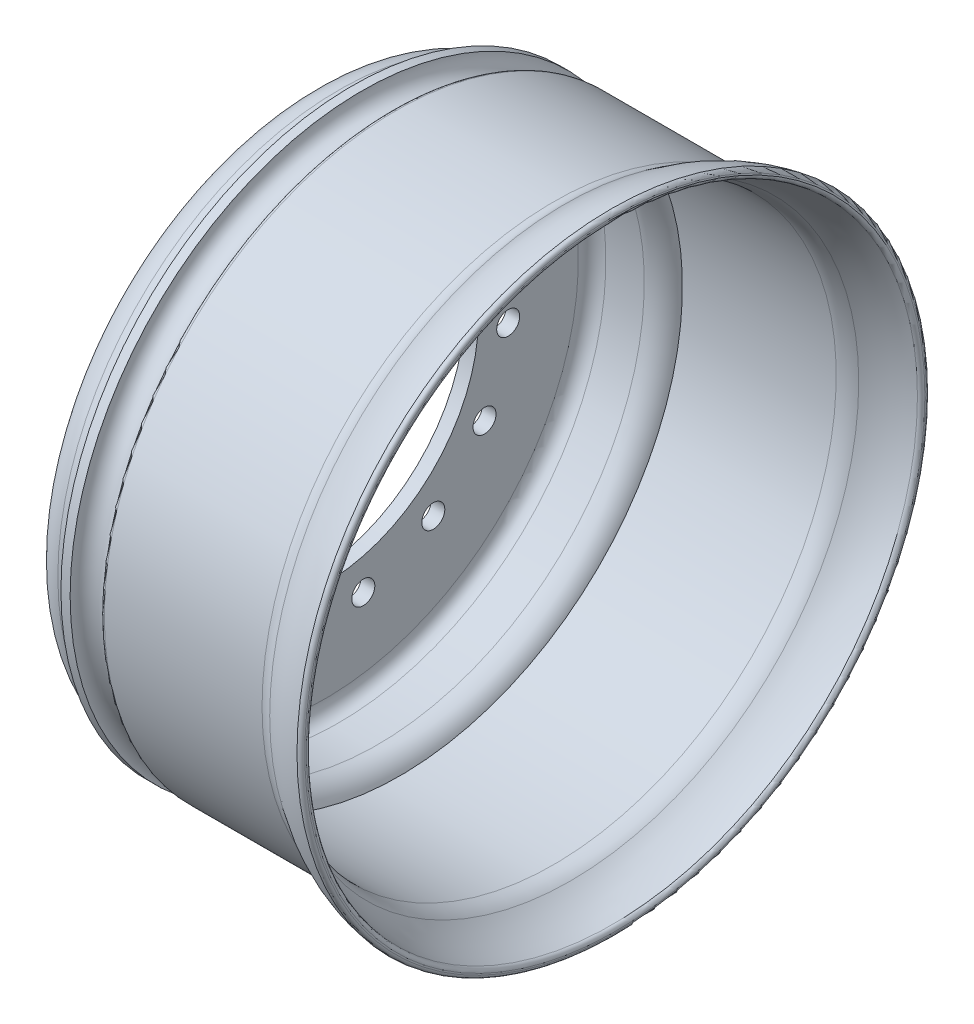
from build123d import *

# Parameters (mm, degrees)
SKETCH2_R          = 7.5
CUT_EXTRUDE1_DEPTH = 352.350672312
CIRPATTERN1_COUNT  = 15
FILLET1_R          = 2.5
FILLET3_R          = 2.5


with BuildPart() as part:
    # Sketch1 → Revolve1 (revolve)
    with BuildSketch(Plane.XY, mode=Mode.PRIVATE) as revolve1_sk:
        with BuildLine():
            Line((26, 190), (131, 190))
            ThreePointArc((131, 190), (134.921324911, 190.630997896), (138.446754178, 192.460286249))
            ThreePointArc((138.446754178, 192.460286249), (153.869493739, 200.934020217), (171, 204.960286249))
            Line((171, 204.960286249), (171.569527007, 198.987377494))
            ThreePointArc((171.569527007, 198.987377494), (156.020298247, 195.332766789), (142.021196184, 187.641223648))
            ThreePointArc((142.021196184, 187.641223648), (136.803560868, 184.933876886), (131, 184))
            Line((131, 184), (30.832396974, 184))
            ThreePointArc((30.832396974, 184), (24.94427191, 176.733500839), (16, 174))
            Line((16, 174), (-9, 174))
            ThreePointArc((-9, 174), (-15.363961031, 171.363961031), (-18, 165))
            Line((-18, 165), (-18, 100))
            Line((-18, 100), (-27, 100))
            Line((-27, 100), (-27, 165))
            ThreePointArc((-27, 165), (-21.727922061, 177.727922061), (-9, 183))
            Line((-9, 183), (1.61250543, 183))
            ThreePointArc((1.61250543, 183), (1.381500916, 183.496194611), (1.167603026, 184))
            Line((1.167603026, 184), (0, 184))
            Line((0, 184), (0, 190))
            Line((0, 190), (6, 190))
            ThreePointArc((6, 190), (16, 180), (26, 190))
        make_face()
    revolve(revolve1_sk.sketch.rotate(Axis((0, 0, 0), (1, 0, 0)), 90), axis=Axis((0, 0, 0), (1, 0, 0)))

    # Sketch2 → Cut-Extrude1 (cut, through all)
    with BuildSketch(Plane.ZY.offset(27)):
        with Locations((0, 120)):
            Circle(SKETCH2_R)
    cut_extrude1 = extrude(amount=-CUT_EXTRUDE1_DEPTH, mode=Mode.SUBTRACT)

    # CirPattern1: Cut-Extrude1 ×15 about axis
    cirpattern1_axis = Axis((0, 0, 0), (1, 0, 0))
    for i in range(1, CIRPATTERN1_COUNT):
        add(cut_extrude1.rotate(cirpattern1_axis, i * 360 / CIRPATTERN1_COUNT), mode=Mode.SUBTRACT)

    # Fillet1
    fillet1_edges = [part.edges().sort_by_distance(p)[0] for p in [
        (171, 0, -204.960286249),
        (171.569527007, 0, -198.987377494),
    ]]
    fillet(fillet1_edges, radius=FILLET1_R)

    # Fillet3
    fillet3_edges = [part.edges().sort_by_distance(p)[0] for p in [
        (26, 0, -190),
    ]]
    fillet(fillet3_edges, radius=FILLET3_R)


solid = part.part
